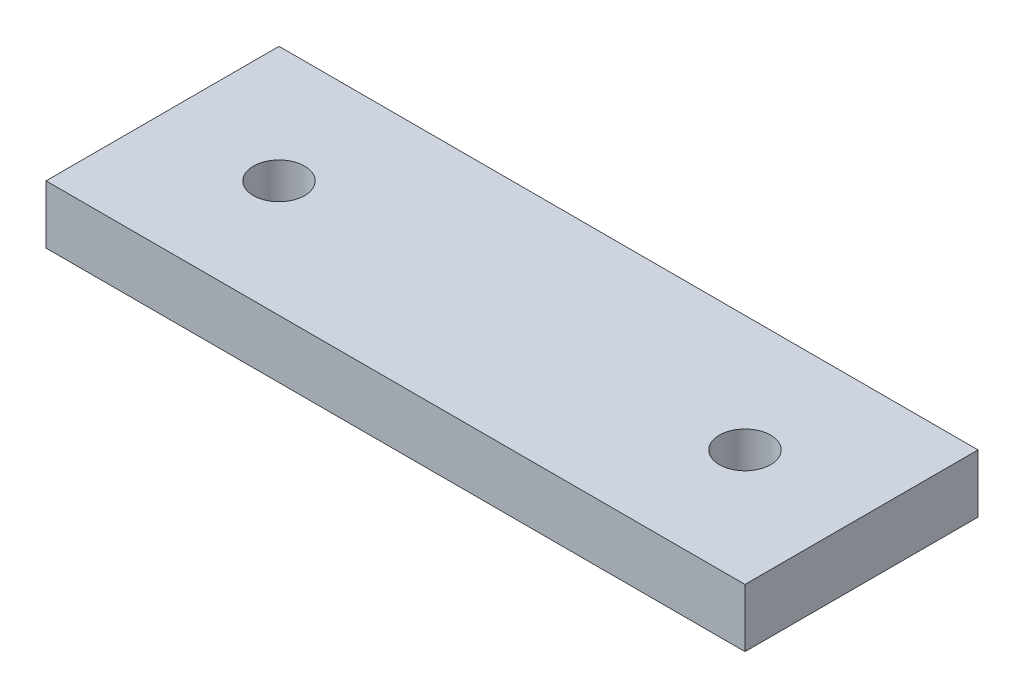
from build123d import *

# Parameters (mm, degrees)
SKETCH1_W           = 76.2
SKETCH1_H           = 25.4
SKETCH1_R           = 2.794
BOSS_EXTRUDE1_DEPTH = 6.35


with BuildPart() as part:
    # Sketch1 → Boss-Extrude1 (new body)
    with BuildSketch(Plane(origin=(0, 0, 0), x_dir=(1, 0, 0), z_dir=(0, 1, 0))):
        with Locations((38.1, 12.7)):
            Rectangle(SKETCH1_W, SKETCH1_H)
        with Locations(Location((63.5, 12.7, 0), (0, 0, 270))):
            Circle(SKETCH1_R, mode=Mode.SUBTRACT)
        with Locations(Location((12.7, 12.7, 0), (0, 0, 270))):
            Circle(SKETCH1_R, mode=Mode.SUBTRACT)
    extrude(amount=BOSS_EXTRUDE1_DEPTH)


solid = part.part
